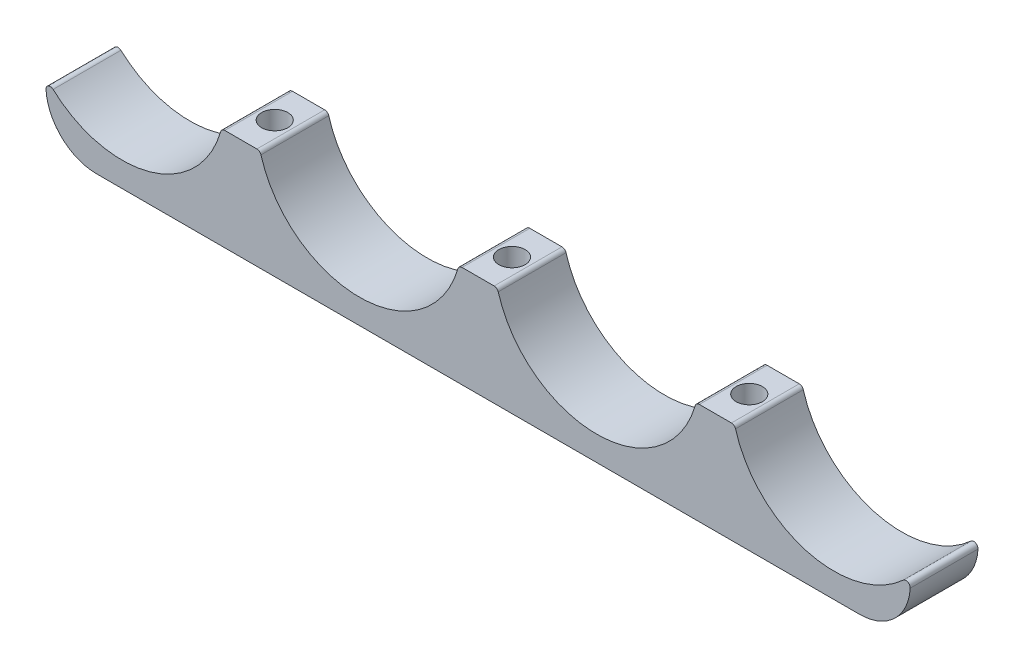
from build123d import *

# Parameters (mm, degrees)
BOSS_EXTRU_1_DEPTH         = 4
CONG_1_R                   = 6
CONG_2_R                   = 0.5
R_P_TITION_LIN_AIRE1_COUNT = 3
R_P_TITION_LIN_AIRE1_PITCH = 28


with BuildPart() as part:
    # Esquisse1 → Boss.-Extru.1 (new, symmetric)
    with BuildSketch(Plane.XY):
        with BuildLine():
            Line((-30.277798842, 12), (-25.722201158, 12))
            ThreePointArc((-25.722201158, 12), (-14, 2.9), (-2.277798842, 12))
            Line((-2.277798842, 12), (2.277798842, 12))
            ThreePointArc((2.277798842, 12), (14, 2.9), (25.722201158, 12))
            Line((25.722201158, 12), (30.277798842, 12))
            ThreePointArc((30.277798842, 12), (39.114930254, 3.24898419), (51, 6.912355102))
            Line((51, 6.912355102), (51, 0))
            Line((51, 0), (-51, 0))
            Line((-51, 0), (-51, 6.912355102))
            ThreePointArc((-51, 6.912355102), (-39.114930254, 3.24898419), (-30.277798842, 12))
        make_face()
    extrude(amount=BOSS_EXTRU_1_DEPTH, both=True)

    # Congé1
    cong_1_edges = [part.edges().sort_by_distance(p)[0] for p in [
        (51, 0, 0),
        (-51, 0, 0),
    ]]
    fillet(cong_1_edges, radius=CONG_1_R)

    # Congé2
    cong_2_edges = [part.edges().sort_by_distance(p)[0] for p in [
        (51, 6.912355102, 0),
        (30.277798842, 12, 0),
        (25.722201158, 12, 0),
        (2.277798842, 12, 0),
        (-2.277798842, 12, 0),
        (-25.722201158, 12, 0),
        (-30.277798842, 12, 0),
        (-51, 6.912355102, 0),
    ]]
    fillet(cong_2_edges, radius=CONG_2_R)

    # Esquisse2 → Enlèvement de matière-Révolution1 (revolve, cut)
    with BuildSketch(Plane.XY, mode=Mode.PRIVATE) as enl_vement_de_mati_re_r_volution1_sk:
        Polygon((-28, 12), (-28, 0), (-24.9, 0), (-24.9, 5.8), (-26.1, 5.8), (-26.1, 9), (-26.45, 9), (-26.45, 12), align=None)
    enl_vement_de_mati_re_r_volution1 = revolve(enl_vement_de_mati_re_r_volution1_sk.sketch.rotate(Axis((-28, 0, 0), (0, -1, 0)), 90), axis=Axis((-28, 0, 0), (0, -1, 0)), mode=Mode.SUBTRACT)

    # Répétition linéaire1: Enlèvement de matière-Révolution1 ×3
    with Locations(*[(i * R_P_TITION_LIN_AIRE1_PITCH, 0, 0) for i in range(1, R_P_TITION_LIN_AIRE1_COUNT)]):
        add(enl_vement_de_mati_re_r_volution1, mode=Mode.SUBTRACT)


solid = part.part
